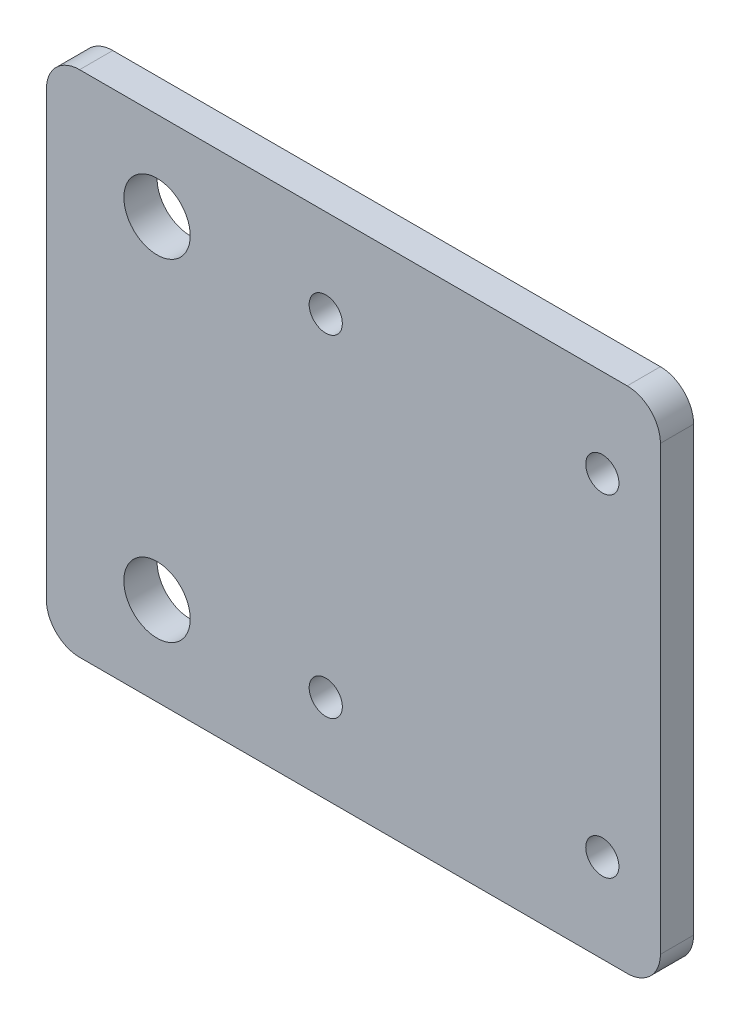
from build123d import *

# Parameters (mm, degrees)
SKETCH_1_R      = 1.5
SKETCH_1_R_2    = 3
EXTRUDE_1_DEPTH = 3


with BuildPart() as part:
    # 草图1 → 凸台-拉伸1 (new body)
    with BuildSketch(Plane.XY):
        with BuildLine():
            Line((56.964417519, -13.748620871), (56.964417519, 26.251379129))
            ThreePointArc((56.964417519, 26.251379129), (56.085737863, 28.372699472), (53.964417519, 29.251379129))
            Line((53.964417519, 29.251379129), (4.464417519, 29.251379129))
            ThreePointArc((4.464417519, 29.251379129), (2.343097176, 28.372699472), (1.464417519, 26.251379129))
            Line((1.464417519, 26.251379129), (1.464417519, -13.748620871))
            ThreePointArc((1.464417519, -13.748620871), (2.343097176, -15.869941215), (4.464417519, -16.748620871))
            Line((4.464417519, -16.748620871), (53.964417519, -16.748620871))
            ThreePointArc((53.964417519, -16.748620871), (56.085737863, -15.869941215), (56.964417519, -13.748620871))
        make_face()
        with Locations((51.714417519, 21.251379129)):
            Circle(SKETCH_1_R, mode=Mode.SUBTRACT)
        with Locations((26.714417519, 21.251379129)):
            Circle(SKETCH_1_R, mode=Mode.SUBTRACT)
        with Locations(Location((26.714417519, -8.748620871, 0), (0, 0, 180))):
            Circle(SKETCH_1_R, mode=Mode.SUBTRACT)
        with Locations(Location((51.714417519, -8.748620871, 0), (0, 0, 180))):
            Circle(SKETCH_1_R, mode=Mode.SUBTRACT)
        with Locations((11.464417519, 21.251379129)):
            Circle(SKETCH_1_R_2, mode=Mode.SUBTRACT)
        with Locations(Location((11.464417519, -8.748620871, 0), (0, 0, 180))):
            Circle(SKETCH_1_R_2, mode=Mode.SUBTRACT)
    extrude(amount=EXTRUDE_1_DEPTH)


solid = part.part
